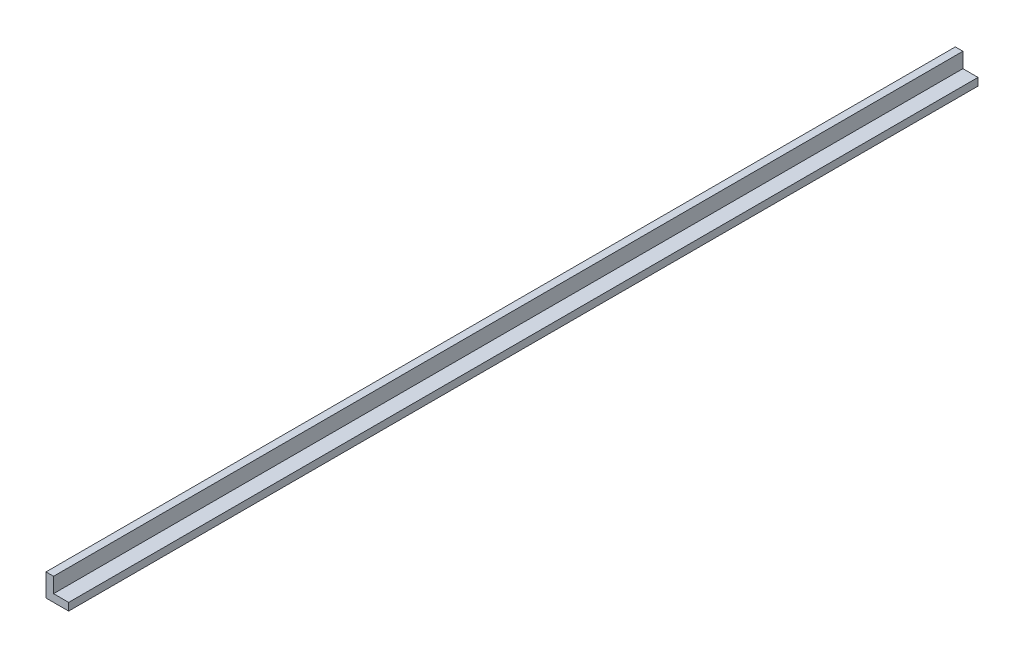
from build123d import *

# Parameters (mm, degrees)
SALIENTE_EXTRUIR1_DEPTH = 6100


with BuildPart() as part:
    # Croquis1 → Saliente-Extruir1 (new body)
    with BuildSketch(Plane.XY):
        Polygon((0, 152), (0, 0), (152, 0), (152, 50.8), (50.8, 50.8), (50.8, 152), align=None)
    extrude(amount=-SALIENTE_EXTRUIR1_DEPTH)


solid = part.part
